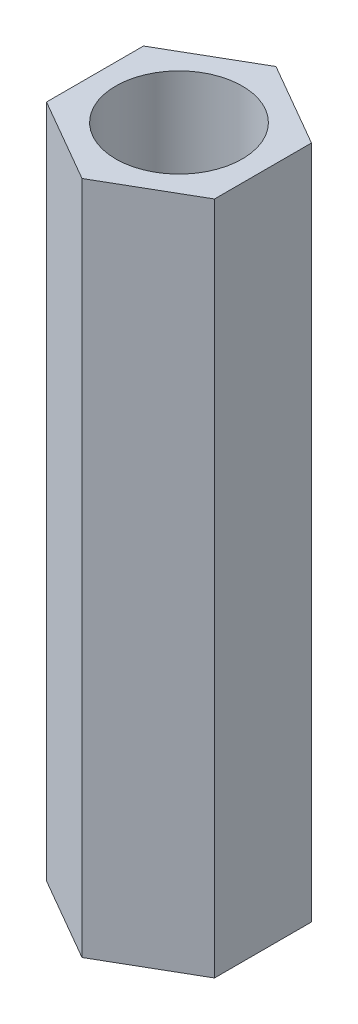
from build123d import *

# Parameters (mm, degrees)
SKETCH_1_R      = 1.5
EXTRUDE_1_DEPTH = 16


with BuildPart() as part:
    # 草图1 → 凸台-拉伸1 (new body)
    with BuildSketch(Plane(origin=(0, 0, 0), x_dir=(1, 0, 0), z_dir=(0, 1, 0))):
        Polygon((1.991858429, 1.15), (0, 2.3), (-1.991858429, 1.15), (-1.991858429, -1.15), (0, -2.3), (1.991858429, -1.15), align=None)
        with Locations(Location((0, 0, 0), (0, 0, 270))):
            Circle(SKETCH_1_R, mode=Mode.SUBTRACT)
    extrude(amount=EXTRUDE_1_DEPTH)


solid = part.part
